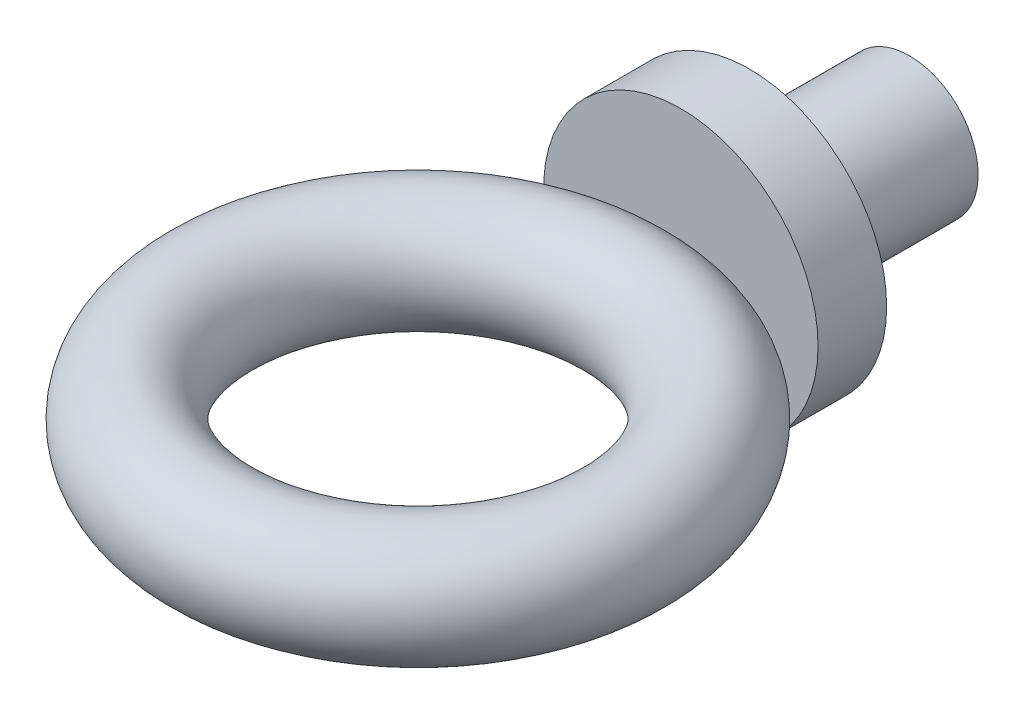
from build123d import *

# Parameters (mm, degrees)
EXTRUDE_START          = -14
EXTRUDE_SKETCH_1_R     = 6
EXTRUDE_1_DEPTH        = 14.5
EXTRUDE_SKETCH_2_R     = 12
EXTRUDE_2_DEPTH        = 6
REVOLVE_PROFILE_1_R    = 5
REVOLVE_ROTATE_1_ANGLE = 90


with BuildPart() as part:
    # Extrude sketch 1 → Extrude 1 (new body)
    with BuildSketch(Plane.XY.offset(EXTRUDE_START)):
        with Locations(Location((0, 0, 0), (0, 0, 180))):
            Circle(EXTRUDE_SKETCH_1_R)
    extrude(amount=EXTRUDE_1_DEPTH)


with BuildPart() as body_2:
    # Extrude sketch 2 → Extrude 2 (new body)
    with BuildSketch(Plane.XY):
        Circle(EXTRUDE_SKETCH_2_R)
    extrude(amount=EXTRUDE_2_DEPTH)


with BuildPart() as body_3:
    # Revolve profile 1 → Revolve 1 (revolve)
    with BuildSketch(Plane(origin=(0, 0, 0), x_dir=(1, 0, 0), z_dir=(0, 1, 0)), mode=Mode.PRIVATE) as revolve_1_sk:
        with Locations((18, 0)):
            Circle(REVOLVE_PROFILE_1_R)
    revolve(revolve_1_sk.sketch.rotate(Axis((0, 0, -10), (0, 0, 1)), 180), axis=Axis((0, 0, -10), (0, 0, 1)))


with BuildPart() as body_3_1:
    # Revolve rotate 1: moved
    add(body_3.part.rotate(Axis((0, 0, 0), (1, 0, 0)), REVOLVE_ROTATE_1_ANGLE))


with BuildPart() as body_3_2:
    # Revolve place 1: moved
    add(body_3_1.part.moved(Location((0, 0, 29))))


solid = Compound([part.part, body_2.part, body_3_2.part])
